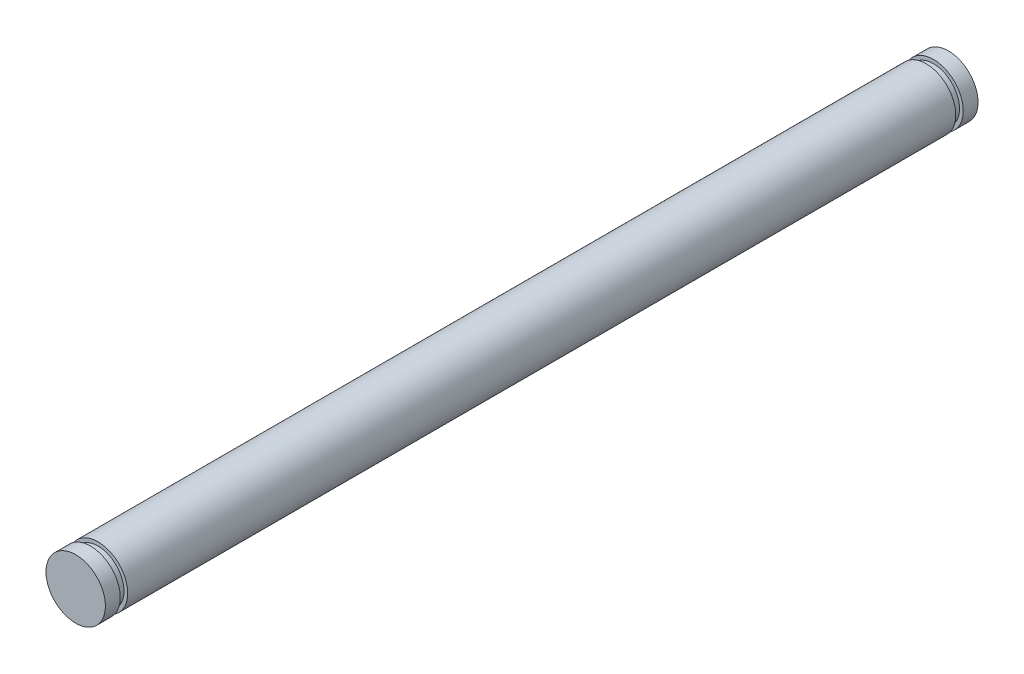
from build123d import *

# Parameters (mm, degrees)
SKETCH_1_R      = 4
EXTRUDE_1_DEPTH = 117.5
SKETCH_2_W      = 0.5
SKETCH_2_H      = 1


with BuildPart() as part:
    # ｽｹｯﾁ1 → ﾎﾞｽ - 押し出し1 (new body)
    with BuildSketch(Plane.XY):
        Circle(SKETCH_1_R)
    extrude(amount=EXTRUDE_1_DEPTH)

    # ｽｹｯﾁ2 → ｶｯﾄ - 回転1 (revolve, cut)
    with BuildSketch(Plane(origin=(0, 0, 0), x_dir=(1, 0, 0), z_dir=(0, 1, 0))):
        with Locations((3.75, -2.5)):
            Rectangle(SKETCH_2_W, SKETCH_2_H)
        with Locations((3.75, -115)):
            Rectangle(SKETCH_2_W, SKETCH_2_H)
    revolve(axis=Axis((0, 0, 117.5), (0, 0, -1)), mode=Mode.SUBTRACT)


solid = part.part
